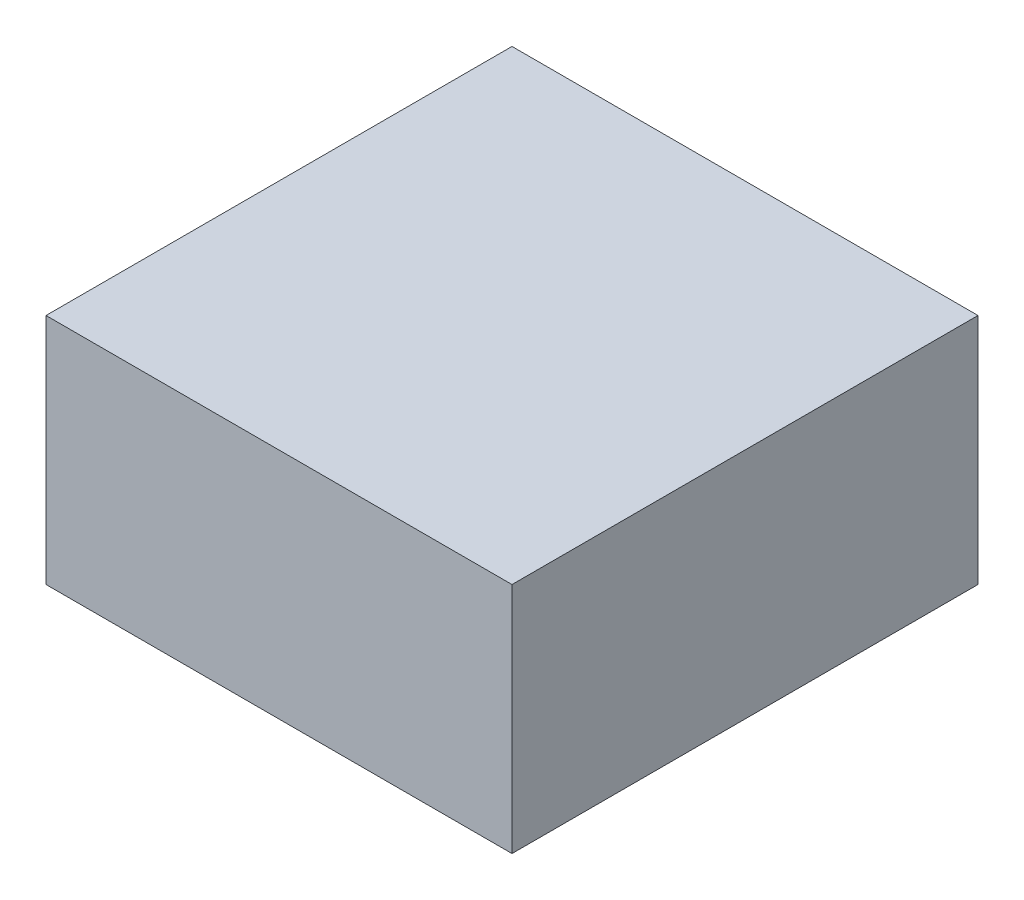
from build123d import *

# Parameters (mm, degrees)
CASE_SKETCH_W = 12.7
CASE_SKETCH_H = 6.35
CASE_2_DEPTH  = 6.35


with BuildPart() as part:
    # Case Sketch → Case 2 (new, symmetric)
    with BuildSketch(Plane(origin=(0, 0, 0), x_dir=(0, 0, -1), z_dir=(1, 0, 0))):
        with Locations((0, 95.825)):
            Rectangle(CASE_SKETCH_W, CASE_SKETCH_H)
    extrude(amount=CASE_2_DEPTH, both=True)


solid = part.part
